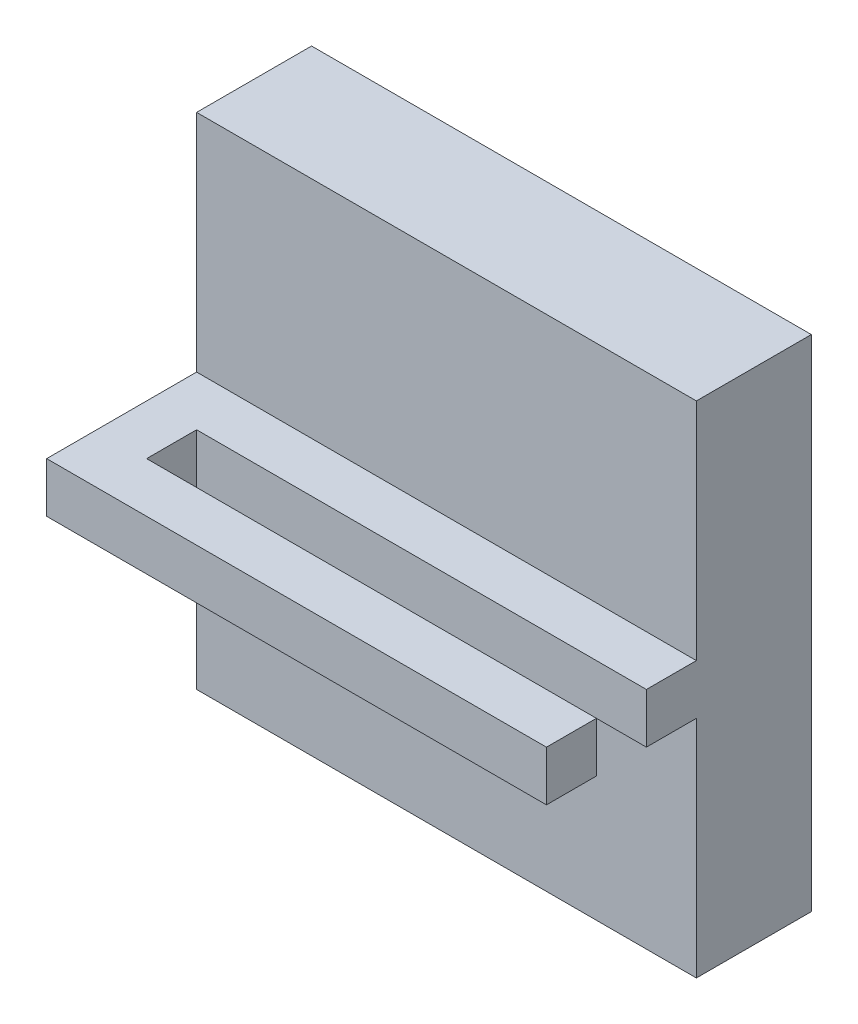
from build123d import *

# Parameters (mm, degrees)
SKETCH1_W           = 100
SKETCH1_H           = 100
BOSS_EXTRUDE1_DEPTH = 23
SKETCH17_W          = 30
SKETCH17_H          = 10
BOSS_EXTRUDE2_DEPTH = 100
SKETCH18_W          = 90
SKETCH18_H          = 10
CUT_EXTRUDE1_DEPTH  = 126.833222958


with BuildPart() as part:
    # Sketch1 → Boss-Extrude1 (new body)
    with BuildSketch(Plane.XY):
        with Locations((50, 50)):
            Rectangle(SKETCH1_W, SKETCH1_H)
    extrude(amount=BOSS_EXTRUDE1_DEPTH)

    # Sketch17 → Boss-Extrude2 (add, through all)
    with BuildSketch(Plane(origin=(0, 0, 0), x_dir=(0, 0, -1), z_dir=(1, 0, 0))):
        with Locations((-38, 50)):
            Rectangle(SKETCH17_W, SKETCH17_H)
    extrude(amount=BOSS_EXTRUDE2_DEPTH)

    # Sketch18 → Cut-Extrude1 (cut, through all)
    with BuildSketch(Plane(origin=(0, 55, 0), x_dir=(1, 0, 0), z_dir=(0, 1, 0))):
        with Locations((55, -38)):
            Rectangle(SKETCH18_W, SKETCH18_H)
    extrude(amount=-CUT_EXTRUDE1_DEPTH, mode=Mode.SUBTRACT)


solid = part.part
